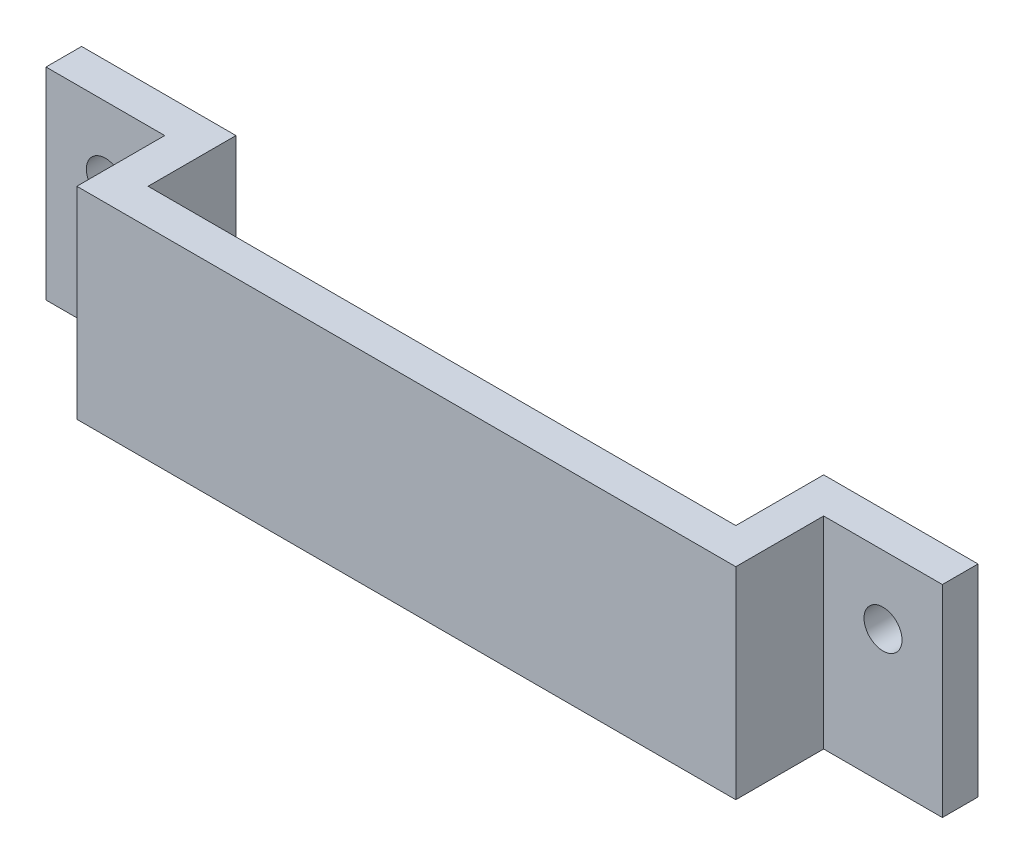
from build123d import *

# Parameters (mm, degrees)
ESBO_O1_W                = 55.5
ESBO_O1_H                = 17
RESSALTO_EXTRUS_O1_DEPTH = 3
ESBO_O9_W                = 3
ESBO_O9_H                = 17
RESSALTO_EXTRUS_O5_DEPTH = 7.4
ESBO_O10_W               = 10
ESBO_O10_H               = 3
RESSALTO_EXTRUS_O6_DEPTH = 17
CORTE_EXTRUS_O4_REACH    = 41.396
ESBO_O11_R               = 1.6


with BuildPart() as part:
    # Esboço1 → Ressalto-extrusão1 (new body)
    with BuildSketch(Plane.XY):
        Rectangle(ESBO_O1_W, ESBO_O1_H)
    extrude(amount=RESSALTO_EXTRUS_O1_DEPTH)

    # Esboço9 → Ressalto-extrusão5 (add)
    with BuildSketch(Plane(origin=(0, 0, 0), x_dir=(-1, 0, 0), z_dir=(0, 0, -1))):
        with Locations((-26.25, 0)):
            Rectangle(ESBO_O9_W, ESBO_O9_H)
        with Locations((26.25, 0)):
            Rectangle(ESBO_O9_W, ESBO_O9_H)
    extrude(amount=RESSALTO_EXTRUS_O5_DEPTH)

    # Esboço10 → Ressalto-extrusão6 (add, through all)
    with BuildSketch(Plane(origin=(0, 8.5, 0), x_dir=(1, 0, 0), z_dir=(0, 1, 0))):
        with Locations((32.75, 5.9)):
            Rectangle(ESBO_O10_W, ESBO_O10_H)
        with Locations((-32.75, 5.9)):
            Rectangle(ESBO_O10_W, ESBO_O10_H)
    extrude(amount=-RESSALTO_EXTRUS_O6_DEPTH)

    # Esboço11 → Corte-extrusão4 (cut, up to next)
    with BuildSketch(Plane.XY.offset(-4.4), mode=Mode.PRIVATE) as corte_extrus_o4_sk1:
        with Locations((-32.75, 2.75)):
            Circle(ESBO_O11_R)
    corte_extrus_o4_tool1 = extrude(corte_extrus_o4_sk1.sketch, amount=-CORTE_EXTRUS_O4_REACH, mode=Mode.PRIVATE) & part.part
    # Esboço11 → Corte-extrusão4 (cut, up to next)
    with BuildSketch(Plane.XY.offset(-4.4), mode=Mode.PRIVATE) as corte_extrus_o4_sk2:
        with Locations(Location((32.75, 2.75, 0), (0, 0, 180))):
            Circle(ESBO_O11_R)
    corte_extrus_o4_tool2 = extrude(corte_extrus_o4_sk2.sketch, amount=-CORTE_EXTRUS_O4_REACH, mode=Mode.PRIVATE) & part.part
    add(corte_extrus_o4_tool1.solids().sort_by_distance((-32.75, 2.75, -4.4))[0], mode=Mode.SUBTRACT)
    add(corte_extrus_o4_tool2.solids().sort_by_distance((32.75, 2.75, -4.4))[0], mode=Mode.SUBTRACT)


solid = part.part
